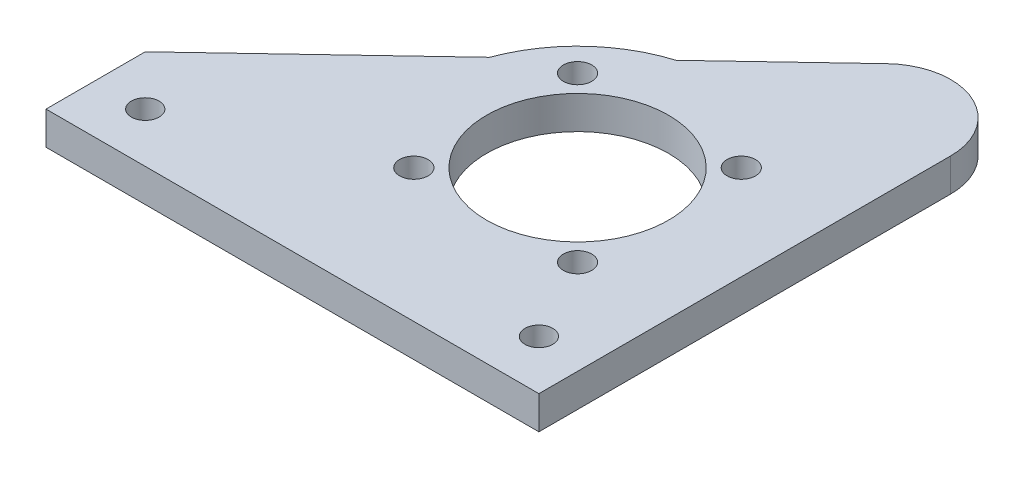
from build123d import *

# Parameters (mm, degrees)
SKETCH_1_R          = 2.1
SKETCH_1_R_2        = 2.15
SKETCH_1_R_3        = 13.75
EXTRUDE_1_DEPTH     = 5
CUT_EXTRUDE_1_DEPTH = 5
FILLET_1_R          = 10


with BuildPart() as part:
    # ｽｹｯﾁ1 → ﾎﾞｽ - 押し出し1 (new body)
    with BuildSketch(Plane(origin=(0, 0, 0), x_dir=(1, 0, 0), z_dir=(0, 1, 0))):
        with BuildLine():
            Line((5, -7.5), (5, 0))
            Line((5, 0), (5, 90))
            Line((5, 90), (5, 95))
            Line((5, 95), (-5, 95))
            Line((-5, 95), (-56.263686619, 46.507323468))
            ThreePointArc((-56.263686619, 46.507323468), (-65.116217602, 41.345539381), (-70.761470202, 32.793203863))
            Line((-70.761470202, 32.793203863), (-97.5, 7.5))
            Line((-97.5, 7.5), (-97.5, -7.5))
            Line((-97.5, -7.5), (0, -7.5))
            Line((0, -7.5), (5, -7.5))
        make_face()
        with Locations(Location((-90, 0, 0), (0, 0, 270))):
            Circle(SKETCH_1_R, mode=Mode.SUBTRACT)
        with Locations(Location((-62.02858956, 12.625631329, 0), (0, 0, 270))):
            Circle(SKETCH_1_R_2, mode=Mode.SUBTRACT)
        with Locations(Location((-49.654220889, 25, 0), (0, 0, 270))):
            Circle(SKETCH_1_R_3, mode=Mode.SUBTRACT)
        with Locations(Location((-62.02858956, 37.374368671, 0), (0, 0, 270))):
            Circle(SKETCH_1_R_2, mode=Mode.SUBTRACT)
        with Locations(Location((-30.5, 0, 0), (0, 0, 270))):
            Circle(SKETCH_1_R, mode=Mode.SUBTRACT)
        with Locations(Location((-37.279852219, 12.625631329, 0), (0, 0, 270))):
            Circle(SKETCH_1_R_2, mode=Mode.SUBTRACT)
        with Locations(Location((0, 0, 0), (0, 0, 270))):
            Circle(SKETCH_1_R, mode=Mode.SUBTRACT)
        with Locations(Location((-37.279852219, 37.374368671, 0), (0, 0, 270))):
            Circle(SKETCH_1_R_2, mode=Mode.SUBTRACT)
        with Locations(Location((0, 90, 0), (0, 0, 270))):
            Circle(SKETCH_1_R_2, mode=Mode.SUBTRACT)
    extrude(amount=EXTRUDE_1_DEPTH)

    # ｽｹｯﾁ2 → ｶｯﾄ - 押し出し1 (cut)
    with BuildSketch(Plane(origin=(0, 5, 0), x_dir=(1, 0, 0), z_dir=(0, 1, 0))):
        Polygon((-23, -7.5), (-23, 77.972972973), (-5, 95), (5, 95), (5, -7.5), align=None)
    extrude(amount=-CUT_EXTRUDE_1_DEPTH, mode=Mode.SUBTRACT)

    # ﾌｨﾚｯﾄ1
    fillet_1_edges = [part.edges().sort_by_distance(p)[0] for p in [
        (-23, 2.5, -77.972972973),
    ]]
    fillet(fillet_1_edges, radius=FILLET_1_R)


solid = part.part
